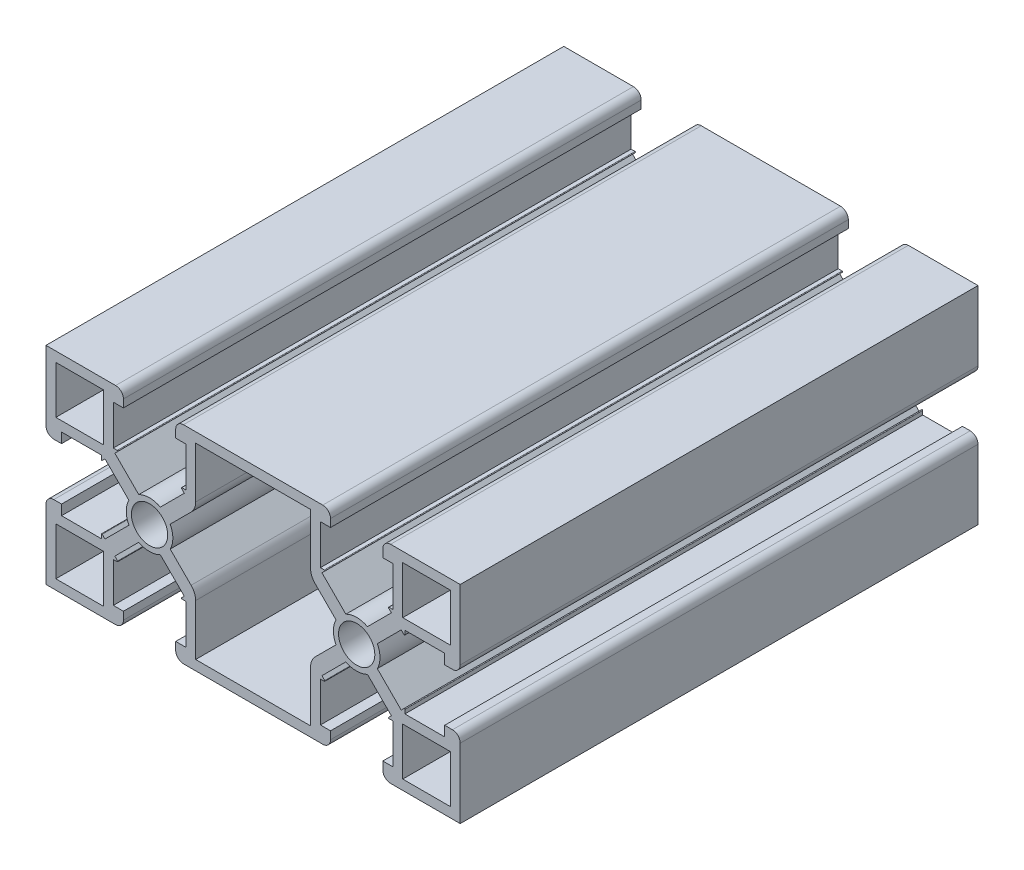
from build123d import *

# Parameters (mm, degrees)
SKETCH_1_R      = 3.5
SKETCH_1_W      = 9.2
SKETCH_1_H      = 9.2
EXTRUDE_3_DEPTH = 100


with BuildPart() as part:
    # 草图1 → 凸台-拉伸3 (new body)
    with BuildSketch(Plane.XY):
        with BuildLine():
            Line((-27, 17), (-27, 9.314213562))
            Line((-27, 9.314213562), (-26.241421356, 9.314213562))
            ThreePointArc((-26.241421356, 9.314213562), (-26.149033403, 9.252481906), (-26.170710678, 9.143502884))
            Line((-26.170710678, 9.143502884), (-26.707106781, 8.607106781))
            Line((-26.707106781, 8.607106781), (-22.086856928, 3.986856928))
            ThreePointArc((-22.086856928, 3.986856928), (-20, 4.5), (-17.913143072, 3.986856928))
            Line((-17.913143072, 3.986856928), (-13.292893219, 8.607106781))
            Line((-13.292893219, 8.607106781), (-13.829289322, 9.143502884))
            ThreePointArc((-13.829289322, 9.143502884), (-13.850966597, 9.252481906), (-13.758578644, 9.314213562))
            Line((-13.758578644, 9.314213562), (-13, 9.314213562))
            Line((-13, 9.314213562), (-13, 17))
            Line((-13, 17), (-14.95, 17))
            Line((-14.95, 17), (-14.95, 18.5))
            ThreePointArc((-14.95, 18.5), (-14.510660172, 19.560660172), (-13.45, 20))
            Line((-13.45, 20), (13.45, 20))
            ThreePointArc((13.45, 20), (14.510660172, 19.560660172), (14.95, 18.5))
            Line((14.95, 18.5), (14.95, 17))
            Line((14.95, 17), (13, 17))
            Line((13, 17), (13, 9.314213562))
            Line((13, 9.314213562), (13.758578644, 9.314213562))
            ThreePointArc((13.758578644, 9.314213562), (13.850966597, 9.252481906), (13.829289322, 9.143502884))
            Line((13.829289322, 9.143502884), (13.292893219, 8.607106781))
            Line((13.292893219, 8.607106781), (17.913143072, 3.986856928))
            ThreePointArc((17.913143072, 3.986856928), (20, 4.5), (22.086856928, 3.986856928))
            Line((22.086856928, 3.986856928), (26.707106781, 8.607106781))
            Line((26.707106781, 8.607106781), (26.170710678, 9.143502884))
            ThreePointArc((26.170710678, 9.143502884), (26.149033403, 9.252481906), (26.241421356, 9.314213562))
            Line((26.241421356, 9.314213562), (27, 9.314213562))
            Line((27, 9.314213562), (27, 17))
            Line((27, 17), (25.05, 17))
            Line((25.05, 17), (25.05, 18.5))
            ThreePointArc((25.05, 18.5), (25.489339828, 19.560660172), (26.55, 20))
            Line((26.55, 20), (40, 20))
            Line((40, 20), (40, 6.55))
            ThreePointArc((40, 6.55), (39.560660172, 5.489339828), (38.5, 5.05))
            Line((38.5, 5.05), (37, 5.05))
            Line((37, 5.05), (37, 7))
            Line((37, 7), (29.314213562, 7))
            Line((29.314213562, 7), (29.314213562, 6.241421356))
            ThreePointArc((29.314213562, 6.241421356), (29.252481906, 6.149033403), (29.143502884, 6.170710678))
            Line((29.143502884, 6.170710678), (28.607106781, 6.707106781))
            Line((28.607106781, 6.707106781), (23.986856928, 2.086856928))
            ThreePointArc((23.986856928, 2.086856928), (24.5, 0), (23.986856928, -2.086856928))
            Line((23.986856928, -2.086856928), (28.607106781, -6.707106781))
            Line((28.607106781, -6.707106781), (29.143502884, -6.170710678))
            ThreePointArc((29.143502884, -6.170710678), (29.252481906, -6.149033403), (29.314213562, -6.241421356))
            Line((29.314213562, -6.241421356), (29.314213562, -7))
            Line((29.314213562, -7), (37, -7))
            Line((37, -7), (37, -5.05))
            Line((37, -5.05), (38.5, -5.05))
            ThreePointArc((38.5, -5.05), (39.560660172, -5.489339828), (40, -6.55))
            Line((40, -6.55), (40, -20))
            Line((40, -20), (26.55, -20))
            ThreePointArc((26.55, -20), (25.489339828, -19.560660172), (25.05, -18.5))
            Line((25.05, -18.5), (25.05, -17))
            Line((25.05, -17), (27, -17))
            Line((27, -17), (27, -9.314213562))
            Line((27, -9.314213562), (26.241421356, -9.314213562))
            ThreePointArc((26.241421356, -9.314213562), (26.149033403, -9.252481906), (26.170710678, -9.143502884))
            Line((26.170710678, -9.143502884), (26.707106781, -8.607106781))
            Line((26.707106781, -8.607106781), (22.086856928, -3.986856928))
            ThreePointArc((22.086856928, -3.986856928), (20, -4.5), (17.913143072, -3.986856928))
            Line((17.913143072, -3.986856928), (13.292893219, -8.607106781))
            Line((13.292893219, -8.607106781), (13.829289322, -9.143502884))
            ThreePointArc((13.829289322, -9.143502884), (13.850966597, -9.252481906), (13.758578644, -9.314213562))
            Line((13.758578644, -9.314213562), (13, -9.314213562))
            Line((13, -9.314213562), (13, -17))
            Line((13, -17), (14.95, -17))
            Line((14.95, -17), (14.95, -18.5))
            ThreePointArc((14.95, -18.5), (14.510660172, -19.560660172), (13.45, -20))
            Line((13.45, -20), (-13.45, -20))
            ThreePointArc((-13.45, -20), (-14.510660172, -19.560660172), (-14.95, -18.5))
            Line((-14.95, -18.5), (-14.95, -17))
            Line((-14.95, -17), (-13, -17))
            Line((-13, -17), (-13, -9.314213562))
            Line((-13, -9.314213562), (-13.758578644, -9.314213562))
            ThreePointArc((-13.758578644, -9.314213562), (-13.850966597, -9.252481906), (-13.829289322, -9.143502884))
            Line((-13.829289322, -9.143502884), (-13.292893219, -8.607106781))
            Line((-13.292893219, -8.607106781), (-17.913143072, -3.986856928))
            ThreePointArc((-17.913143072, -3.986856928), (-20, -4.5), (-22.086856928, -3.986856928))
            Line((-22.086856928, -3.986856928), (-26.707106781, -8.607106781))
            Line((-26.707106781, -8.607106781), (-26.170710678, -9.143502884))
            ThreePointArc((-26.170710678, -9.143502884), (-26.149033403, -9.252481906), (-26.241421356, -9.314213562))
            Line((-26.241421356, -9.314213562), (-27, -9.314213562))
            Line((-27, -9.314213562), (-27, -17))
            Line((-27, -17), (-25.05, -17))
            Line((-25.05, -17), (-25.05, -18.5))
            ThreePointArc((-25.05, -18.5), (-25.489339828, -19.560660172), (-26.55, -20))
            Line((-26.55, -20), (-40, -20))
            Line((-40, -20), (-40, -6.55))
            ThreePointArc((-40, -6.55), (-39.560660172, -5.489339828), (-38.5, -5.05))
            Line((-38.5, -5.05), (-37, -5.05))
            Line((-37, -5.05), (-37, -7))
            Line((-37, -7), (-29.314213562, -7))
            Line((-29.314213562, -7), (-29.314213562, -6.241421356))
            ThreePointArc((-29.314213562, -6.241421356), (-29.252481906, -6.149033403), (-29.143502884, -6.170710678))
            Line((-29.143502884, -6.170710678), (-28.607106781, -6.707106781))
            Line((-28.607106781, -6.707106781), (-23.986856928, -2.086856928))
            ThreePointArc((-23.986856928, -2.086856928), (-24.5, 0), (-23.986856928, 2.086856928))
            Line((-23.986856928, 2.086856928), (-28.607106781, 6.707106781))
            Line((-28.607106781, 6.707106781), (-29.143502884, 6.170710678))
            ThreePointArc((-29.143502884, 6.170710678), (-29.252481906, 6.149033403), (-29.314213562, 6.241421356))
            Line((-29.314213562, 6.241421356), (-29.314213562, 7))
            Line((-29.314213562, 7), (-37, 7))
            Line((-37, 7), (-37, 5.05))
            Line((-37, 5.05), (-38.5, 5.05))
            ThreePointArc((-38.5, 5.05), (-39.560660172, 5.489339828), (-40, 6.55))
            Line((-40, 6.55), (-40, 20))
            Line((-40, 20), (-26.55, 20))
            ThreePointArc((-26.55, 20), (-25.489339828, 19.560660172), (-25.05, 18.5))
            Line((-25.05, 18.5), (-25.05, 17))
            Line((-25.05, 17), (-27, 17))
        make_face()
        with Locations((-20, 0)):
            Circle(SKETCH_1_R, mode=Mode.SUBTRACT)
        with Locations(Location((20, 0, 0), (0, 0, 180))):
            Circle(SKETCH_1_R, mode=Mode.SUBTRACT)
        with Locations((-33.5, 13.5)):
            Rectangle(SKETCH_1_W, SKETCH_1_H, mode=Mode.SUBTRACT)
        with BuildLine():
            Line((-11.978679656, 6.121320344), (-16.013143072, 2.086856928))
            ThreePointArc((-16.013143072, 2.086856928), (-15.5, 0), (-16.013143072, -2.086856928))
            Line((-16.013143072, -2.086856928), (-11.978679656, -6.121320344))
            ThreePointArc((-11.978679656, -6.121320344), (-11.328361402, -7.09459039), (-11.1, -8.242640687))
            Line((-11.1, -8.242640687), (-11.1, -18.1))
            Line((-11.1, -18.1), (11.1, -18.1))
            Line((11.1, -18.1), (11.1, -8.242640687))
            ThreePointArc((11.1, -8.242640687), (11.328361402, -7.09459039), (11.978679656, -6.121320344))
            Line((11.978679656, -6.121320344), (16.013143072, -2.086856928))
            ThreePointArc((16.013143072, -2.086856928), (15.5, 0), (16.013143072, 2.086856928))
            Line((16.013143072, 2.086856928), (11.978679656, 6.121320344))
            ThreePointArc((11.978679656, 6.121320344), (11.328361402, 7.09459039), (11.1, 8.242640687))
            Line((11.1, 8.242640687), (11.1, 18.1))
            Line((11.1, 18.1), (-11.1, 18.1))
            Line((-11.1, 18.1), (-11.1, 8.242640687))
            ThreePointArc((-11.1, 8.242640687), (-11.328361402, 7.09459039), (-11.978679656, 6.121320344))
        make_face(mode=Mode.SUBTRACT)
        with Locations((-33.5, -13.5)):
            Rectangle(SKETCH_1_W, SKETCH_1_H, mode=Mode.SUBTRACT)
        with Locations((33.5, -13.5)):
            Rectangle(SKETCH_1_W, SKETCH_1_H, mode=Mode.SUBTRACT)
        with Locations((33.5, 13.5)):
            Rectangle(SKETCH_1_W, SKETCH_1_H, mode=Mode.SUBTRACT)
    extrude(amount=-EXTRUDE_3_DEPTH)


solid = part.part
